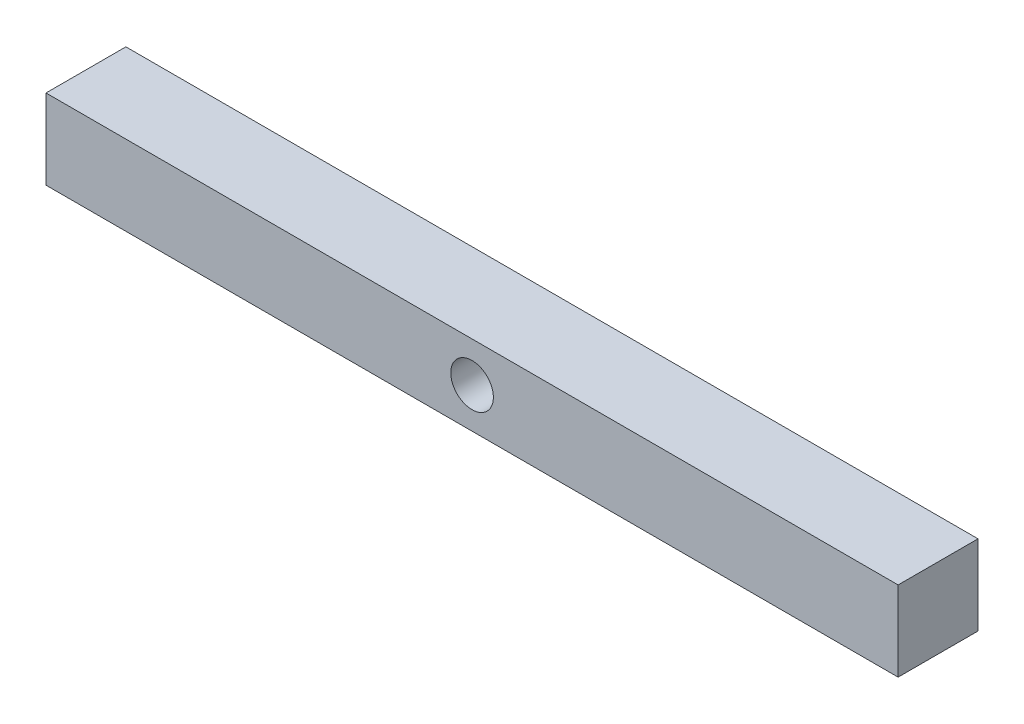
from build123d import *

# Parameters (mm, degrees)
BOSS_EXTRU_1_DEPTH      = 2
BOSS_EXTRU_1_DEPTH_BACK = 1
ESQUISSE1_W             = 32
ESQUISSE1_H             = 3
D_GAGEMENT_M1_61_D      = 1.6


with BuildPart() as part:
    # Esquisse1 → Boss.-Extru.1 (new, two sides: drawn at the far end of the back side and taken through both)
    with BuildSketch(Plane(origin=(0, 0, 0), x_dir=(1, 0, 0), z_dir=(0, 1, 0)).offset(-BOSS_EXTRU_1_DEPTH_BACK)):
        with Locations((16, 1.5)):
            Rectangle(ESQUISSE1_W, ESQUISSE1_H)
    extrude(amount=BOSS_EXTRU_1_DEPTH + BOSS_EXTRU_1_DEPTH_BACK)

    # Dégagement M1.61 (through all)
    with Locations(Plane(origin=(16, 0.5, 0), x_dir=(1, 0, 0), z_dir=(0, 0, 1))):
        with Locations((0, 0)):
            Hole(D_GAGEMENT_M1_61_D / 2)


solid = part.part
